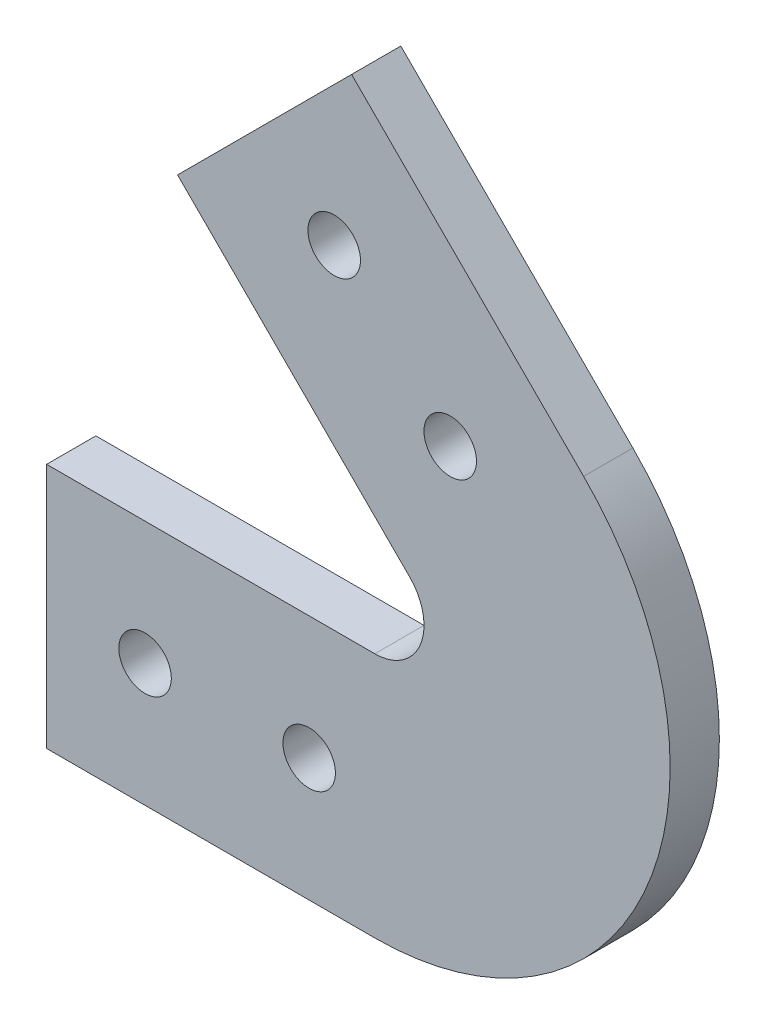
from build123d import *

# Parameters (mm, degrees)
SKETCH_1_W          = 20
SKETCH_1_H          = 15
EXTRUDE_1_DEPTH     = 3
SKETCH_2_R          = 1.6
CUT_EXTRUDE_1_DEPTH = 3


with BuildPart() as part:
    # 草图1 → 凸台-拉伸1 (new body)
    with BuildSketch(Plane.XY):
        Polygon((62.111299198, 206.50315886), (76.253434822, 192.361023236), (86.86003654, 202.967624954), (72.717900916, 217.109760578), align=None)
        with BuildLine():
            ThreePointArc((86.86003654, 202.967624954), (90.761946064, 183.35140111), (74.132114478, 172.239702893))
            Line((74.132114478, 172.239702893), (74.132114478, 187.239702893))
            ThreePointArc((74.132114478, 187.239702893), (76.903753076, 189.091652596), (76.253434822, 192.361023236))
            Line((76.253434822, 192.361023236), (86.86003654, 202.967624954))
        make_face()
        with Locations((64.132114478, 179.739702893)):
            Rectangle(SKETCH_1_W, SKETCH_1_H)
    extrude(amount=EXTRUDE_1_DEPTH)

    # 草图2 → 切除-拉伸1 (cut)
    with BuildSketch(Plane.XY.offset(3)):
        with Locations((71.657240744, 207.563819032)):
            Circle(SKETCH_2_R)
        with Locations((78.728308556, 200.49275122)):
            Circle(SKETCH_2_R)
        with Locations((60.132114478, 179.739702893)):
            Circle(SKETCH_2_R)
        with Locations((70.132114478, 179.739702893)):
            Circle(SKETCH_2_R)
    extrude(amount=-CUT_EXTRUDE_1_DEPTH, mode=Mode.SUBTRACT)


solid = part.part
